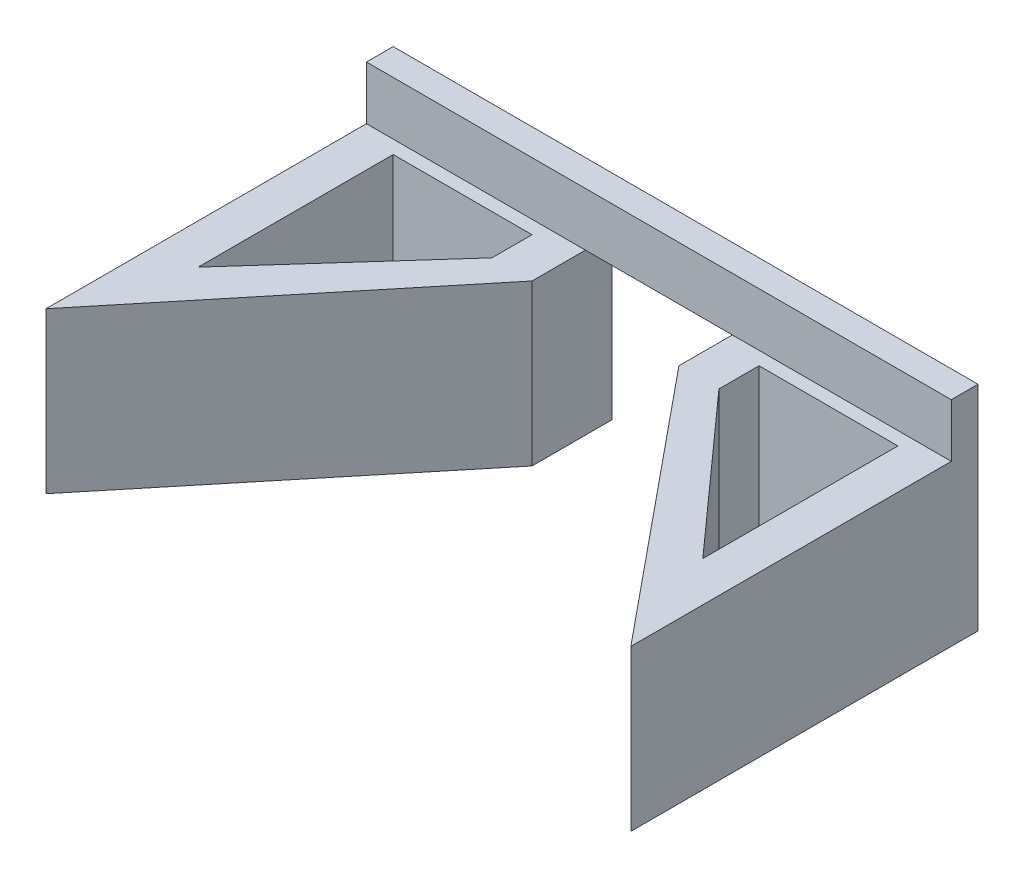
from build123d import *

# Parameters (mm, degrees)
BOSS_EXTRUDE1_DEPTH   = 60
BOSS_EXTRUDE1_2_DEPTH = 60
SKETCH3_W             = 219
SKETCH3_H             = 10
BOSS_EXTRUDE3_DEPTH   = 20


with BuildPart() as part:
    # Sketch1 → Boss-Extrude1 (new body)
    with BuildSketch(Plane(origin=(0, 0, 0), x_dir=(1, 0, 0), z_dir=(0, 1, 0))):
        Polygon((-109.5, 12.700803213), (-109.5, -87.299196787), (-27.5, 12.700803213), (-27.5, 42.700803213), (-109.5, 42.700803213), align=None)
        Polygon((-94.5, 27.700803213), (-94.5, -45.350177528), (-42.5, 12.700803213), (-42.5, 27.700803213), align=None, mode=Mode.SUBTRACT)
    extrude(amount=BOSS_EXTRUDE1_DEPTH)



with BuildPart() as body_2:
    # Sketch1 → Boss-Extrude1 2 (new body)
    with BuildSketch(Plane(origin=(0, 0, 0), x_dir=(1, 0, 0), z_dir=(0, 1, 0))):
        Polygon((109.5, 42.700803213), (27.5, 42.700803213), (27.5, 12.700803213), (109.5, -87.299196787), (109.5, 12.700803213), align=None)
        Polygon((42.5, 12.700803213), (42.5, 27.700803213), (94.5, 27.700803213), (94.5, -45.350177528), align=None, mode=Mode.SUBTRACT)
    extrude(amount=BOSS_EXTRUDE1_2_DEPTH)


with BuildPart() as part_1:
    add(part.part)

    add(body_2.part)  # Boss-Extrude3 merges body 2
    # Sketch3 → Boss-Extrude3 (add)
    with BuildSketch(Plane(origin=(0, 60, 0), x_dir=(1, 0, 0), z_dir=(0, 1, 0))):
        with Locations((0, 37.700803213)):
            Rectangle(SKETCH3_W, SKETCH3_H)
    extrude(amount=BOSS_EXTRUDE3_DEPTH)


solid = part_1.part
